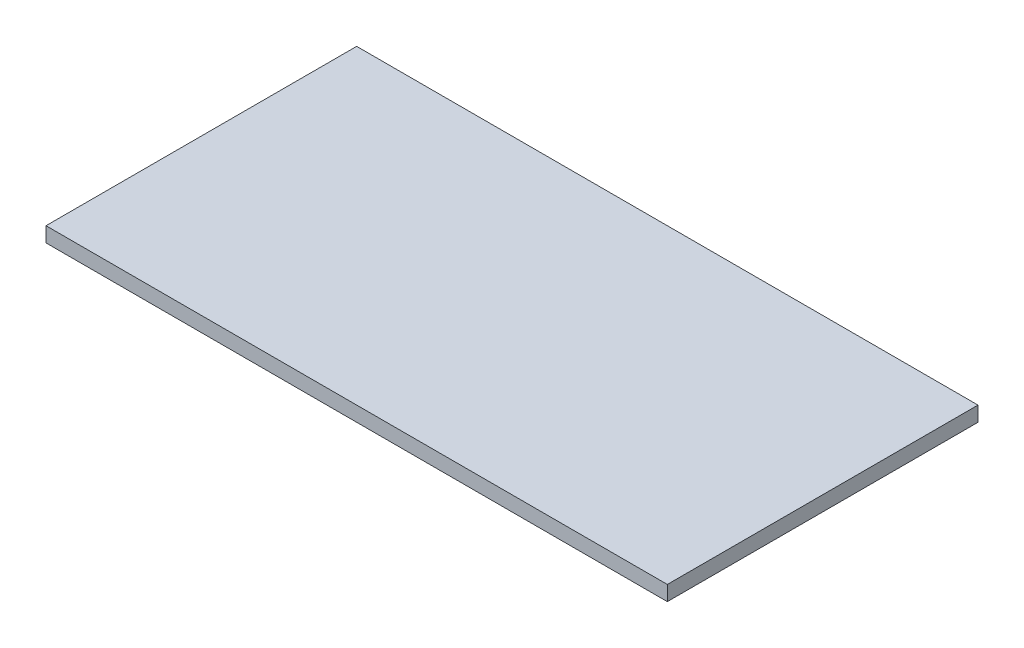
from build123d import *

# Parameters (mm, degrees)
SKETCH1_W           = 100
SKETCH1_H           = 50
BOSS_EXTRUDE1_DEPTH = 2.4


with BuildPart() as part:
    # Sketch1 → Boss-Extrude1 (new body)
    with BuildSketch(Plane(origin=(0, 0, 0), x_dir=(1, 0, 0), z_dir=(0, 1, 0))):
        Rectangle(SKETCH1_W, SKETCH1_H)
    extrude(amount=BOSS_EXTRUDE1_DEPTH)


solid = part.part
